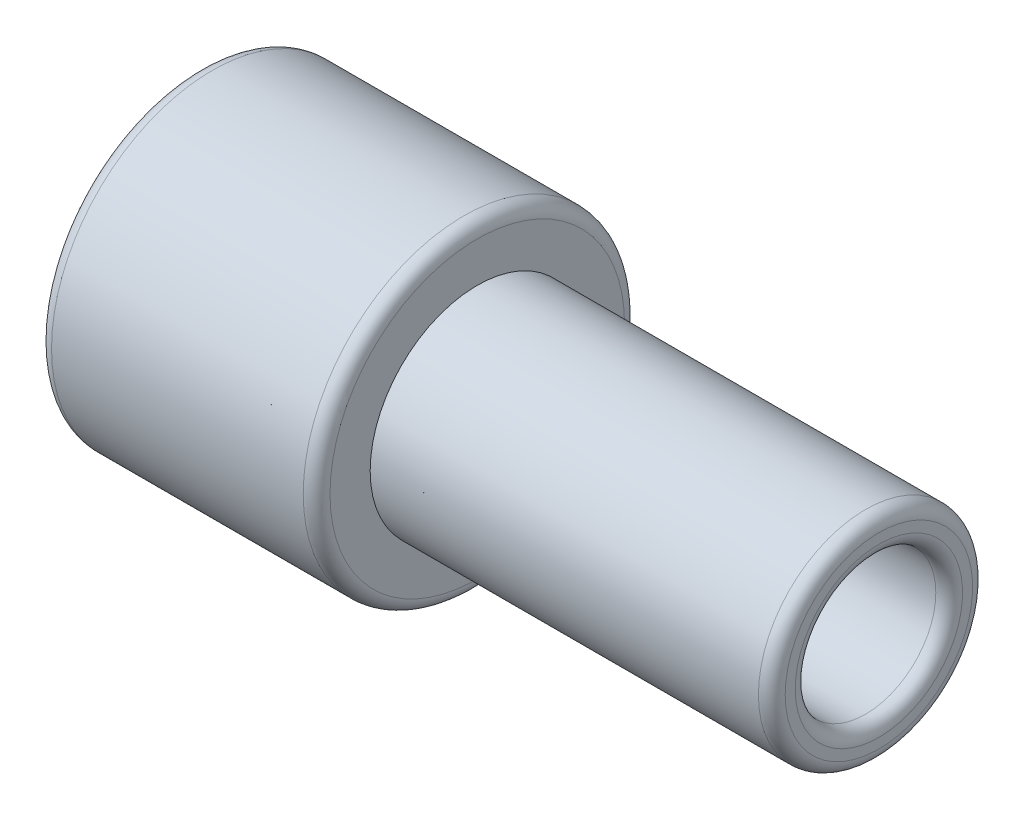
from build123d import *

# Parameters (mm, degrees)
CUT_EXTRUDE1_DEPTH      = 17.370705544
CUT_EXTRUDE1_DEPTH_BACK = 17.370705544
SKETCH2_R               = 2.625
FILLET1_R               = 0.5


with BuildPart() as part:
    # Sketch1 → Revolve1 (revolve)
    with BuildSketch(Plane.XY, mode=Mode.PRIVATE) as revolve1_sk:
        Polygon((-14, 0), (11.4, 0), (11.4, 4), (-3.6, 4), (-3.6, 6), (-14, 6), align=None)
    revolve(revolve1_sk.sketch.rotate(Axis((-1.174323487, 0, 0), (1, 0, 0)), 90), axis=Axis((-1.174323487, 0, 0), (1, 0, 0)))

    # Sketch2 → Cut-Extrude1 (cut, two sides: drawn at the far end of the back side and taken through both)
    with BuildSketch(Plane(origin=(0, 0, 0), x_dir=(0, 0, -1), z_dir=(1, 0, 0)).offset(-CUT_EXTRUDE1_DEPTH_BACK)):
        Circle(SKETCH2_R)
    extrude(amount=CUT_EXTRUDE1_DEPTH + CUT_EXTRUDE1_DEPTH_BACK, mode=Mode.SUBTRACT)

    # Fillet1
    fillet1_edges = [part.edges().sort_by_distance(p)[0] for p in [
        (-14, 0, 2.625),
        (11.4, 0, 2.625),
        (-14, 0, -6),
        (-3.6, 0, -6),
        (11.4, 0, -4),
    ]]
    fillet(fillet1_edges, radius=FILLET1_R)


solid = part.part
